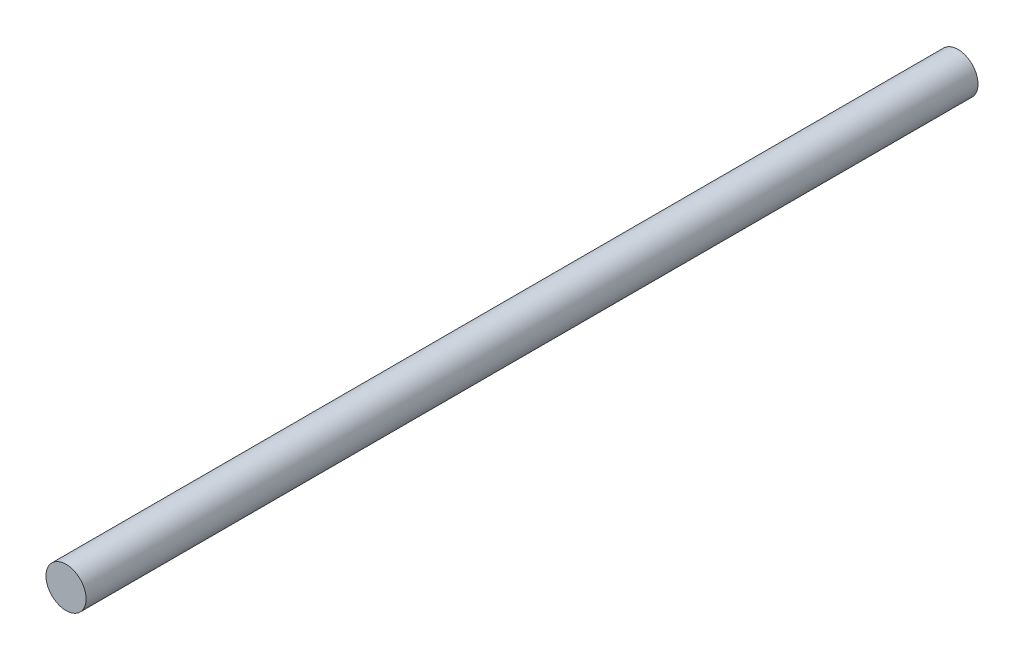
from build123d import *

# Parameters (mm, degrees)
ESBO_O1_R                = 4.2
RESSALTO_EXTRUS_O1_DEPTH = 186.6


with BuildPart() as part:
    # Esboço1 → Ressalto-extrusão1 (new body)
    with BuildSketch(Plane.XY):
        Circle(ESBO_O1_R)
    extrude(amount=RESSALTO_EXTRUS_O1_DEPTH)


solid = part.part
